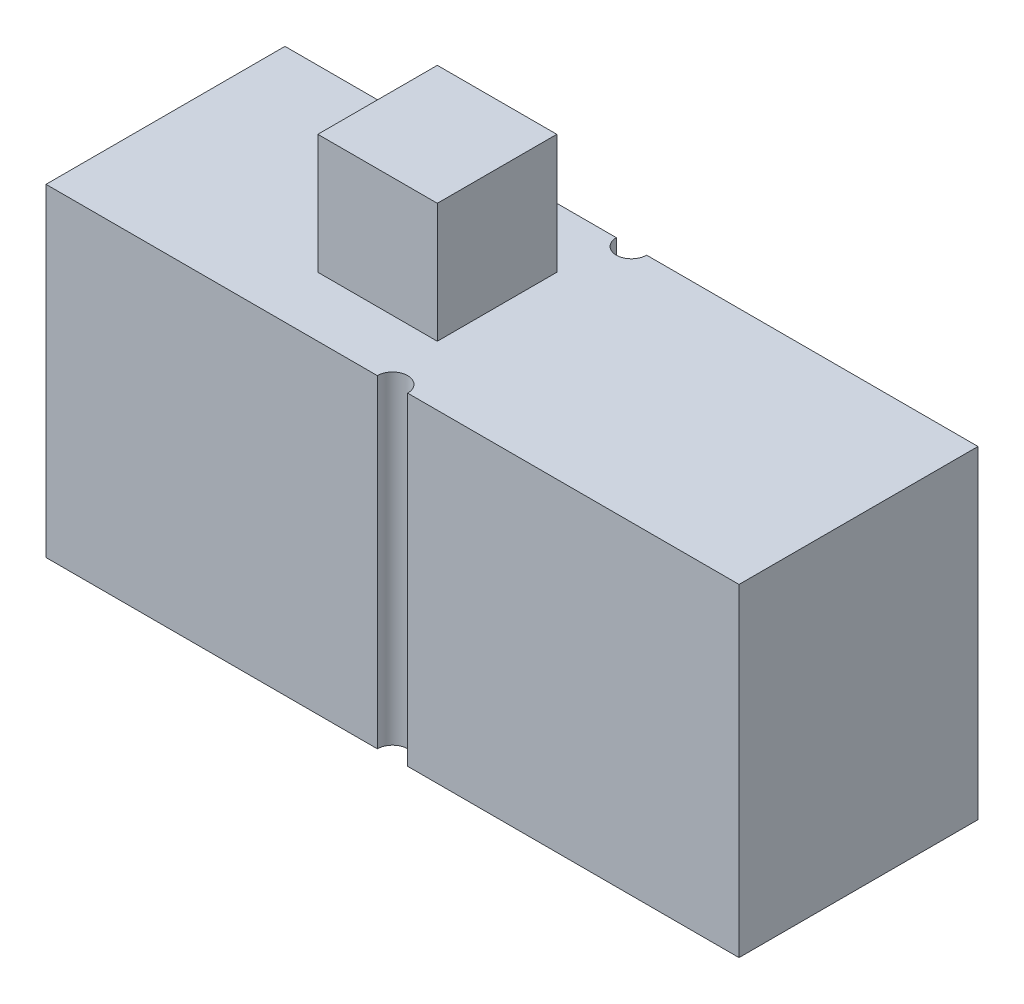
from build123d import *

# Parameters (mm, degrees)
SKETCH1_W               = 11.6
SKETCH1_H               = 5.4102
BOSS_EXTRUDE1_DEPTH     = 4
SKETCH2_W               = 2
SKETCH2_H               = 2
BOSS_EXTRUDE2_DEPTH     = 2
CUT_EXTRUDE1_DEPTH      = 9.883144941
CUT_EXTRUDE1_DEPTH_BACK = 9.883144941


with BuildPart() as part:
    # Sketch1 → Boss-Extrude1 (new body)
    with BuildSketch(Plane.XY):
        Rectangle(SKETCH1_W, SKETCH1_H)
    extrude(amount=BOSS_EXTRUDE1_DEPTH)

    # Sketch2 → Boss-Extrude2 (add)
    with BuildSketch(Plane(origin=(0, 2.7051, 0), x_dir=(1, 0, 0), z_dir=(0, 1, 0))):
        with Locations((-1.25, -2)):
            Rectangle(SKETCH2_W, SKETCH2_H)
    extrude(amount=BOSS_EXTRUDE2_DEPTH)

    # Sketch3 → Cut-Extrude1 (cut, two sides: drawn at the far end of the back side and taken through both)
    with BuildSketch(Plane(origin=(0, 2.7051, 0), x_dir=(1, 0, 0), z_dir=(0, 1, 0)).offset(-CUT_EXTRUDE1_DEPTH_BACK)):
        with BuildLine():
            Line((-0.254, 0), (0.254, 0))
            ThreePointArc((0.254, 0), (0, -0.254), (-0.254, 0))
        make_face()
        with BuildLine():
            Line((-0.254, -4), (0.254, -4))
            ThreePointArc((0.254, -4), (0, -3.746), (-0.254, -4))
        make_face()
    extrude(amount=CUT_EXTRUDE1_DEPTH + CUT_EXTRUDE1_DEPTH_BACK, mode=Mode.SUBTRACT)


solid = part.part
